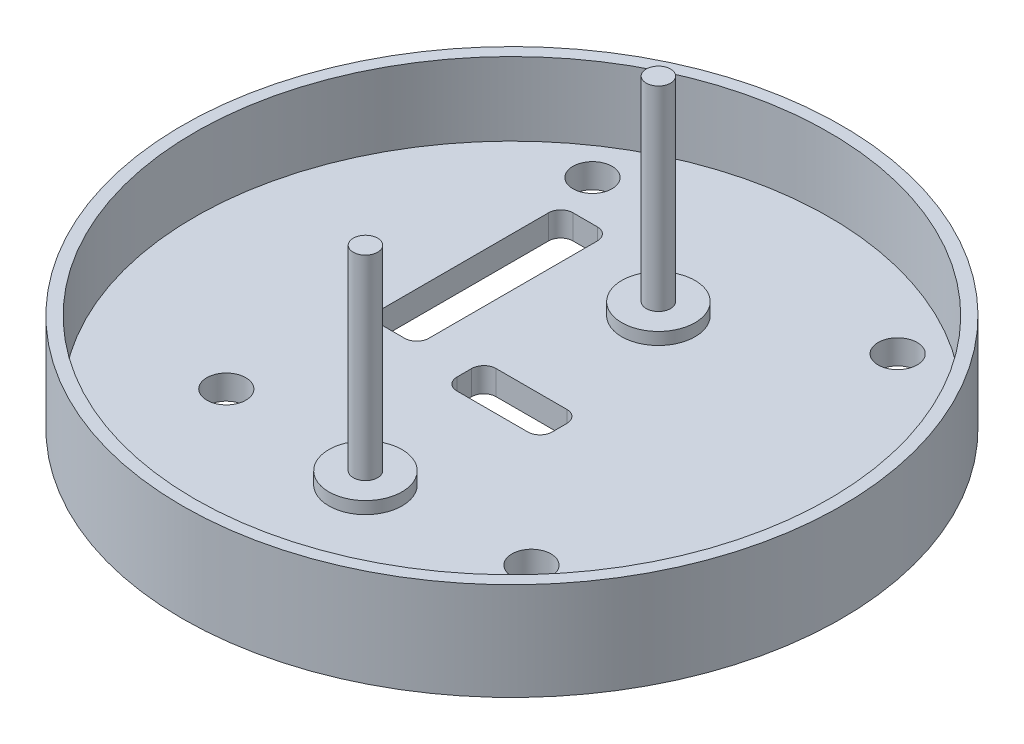
from build123d import *

# Parameters (mm, degrees)
SKETCH1_R           = 34.29
BOSS_EXTRUDE1_DEPTH = 10.16
SKETCH2_R           = 33.02
CUT_EXTRUDE1_DEPTH  = 7.62
SKETCH3_R           = 3.81
BOSS_EXTRUDE2_DEPTH = 1.27
SKETCH4_R           = 1.27
BOSS_EXTRUDE3_DEPTH = 20.32
CUT_EXTRUDE3_REACH  = 55.082
CUT_EXTRUDE4_REACH  = 55.082
CUT_EXTRUDE5_REACH  = 56.165
SKETCH11_R          = 2.032


with BuildPart() as part:
    # Sketch1 → Boss-Extrude1 (new body)
    with BuildSketch(Plane(origin=(0, 0, 0), x_dir=(1, 0, 0), z_dir=(0, 1, 0))):
        with Locations(Location((0, 0, 0), (0, 0, 270))):
            Circle(SKETCH1_R)
    extrude(amount=BOSS_EXTRUDE1_DEPTH)

    # Sketch2 → Cut-Extrude1 (cut)
    with BuildSketch(Plane(origin=(0, 10.16, 0), x_dir=(1, 0, 0), z_dir=(0, 1, 0))):
        with Locations(Location((0, 0, 0), (0, 0, 270))):
            Circle(SKETCH2_R)
    extrude(amount=-CUT_EXTRUDE1_DEPTH, mode=Mode.SUBTRACT)

    # Sketch3 → Boss-Extrude2 (add)
    with BuildSketch(Plane(origin=(0, 2.54, 0), x_dir=(1, 0, 0), z_dir=(0, 1, 0))):
        with Locations(Location((0, -15.24, 0), (0, 0, 270))):
            Circle(SKETCH3_R)
        with Locations(Location((0, 15.24, 0), (0, 0, 270))):
            Circle(SKETCH3_R)
    extrude(amount=BOSS_EXTRUDE2_DEPTH)

    # Sketch4 → Boss-Extrude3 (add)
    with BuildSketch(Plane(origin=(0, 3.81, 0), x_dir=(1, 0, 0), z_dir=(0, 1, 0))):
        with Locations(Location((0, -15.24, 0), (0, 0, 270))):
            Circle(SKETCH4_R)
        with Locations(Location((0, 15.24, 0), (0, 0, 270))):
            Circle(SKETCH4_R)
    extrude(amount=BOSS_EXTRUDE3_DEPTH)

    # Sketch8 → Cut-Extrude3 (cut, up to next)
    with BuildSketch(Plane(origin=(0, 2.54, 0), x_dir=(1, 0, 0), z_dir=(0, 1, 0)), mode=Mode.PRIVATE) as cut_extrude3_sk1:
        with BuildLine():
            Line((3.683, 2.032), (-3.683, 2.032))
            ThreePointArc((-3.683, 2.032), (-4.581025612, 1.660025612), (-4.953, 0.762))
            Line((-4.953, 0.762), (-4.953, -0.762))
            ThreePointArc((-4.953, -0.762), (-4.581025612, -1.660025612), (-3.683, -2.032))
            Line((-3.683, -2.032), (3.683, -2.032))
            ThreePointArc((3.683, -2.032), (4.581025612, -1.660025612), (4.953, -0.762))
            Line((4.953, -0.762), (4.953, 0.762))
            ThreePointArc((4.953, 0.762), (4.581025612, 1.660025612), (3.683, 2.032))
        make_face()
    cut_extrude3_tool1 = extrude(cut_extrude3_sk1.sketch, amount=-CUT_EXTRUDE3_REACH, mode=Mode.PRIVATE) & part.part
    add(cut_extrude3_tool1.solids().sort_by_distance((0, 2.54, 0))[0], mode=Mode.SUBTRACT)

    # Sketch9 → Cut-Extrude4 (cut, up to next)
    with BuildSketch(Plane(origin=(0, 2.54, 0), x_dir=(1, 0, 0), z_dir=(0, 1, 0)), mode=Mode.PRIVATE) as cut_extrude4_sk1:
        with BuildLine():
            Line((-13.716, 0), (-11.176, 0))
            ThreePointArc((-11.176, 0), (-10.277974388, 0.371974388), (-9.906, 1.27))
            Line((-9.906, 1.27), (-9.906, 18.796))
            ThreePointArc((-9.906, 18.796), (-10.277974388, 19.694025612), (-11.176, 20.066))
            Line((-11.176, 20.066), (-13.716, 20.066))
            ThreePointArc((-13.716, 20.066), (-14.614025612, 19.694025612), (-14.986, 18.796))
            Line((-14.986, 18.796), (-14.986, 1.27))
            ThreePointArc((-14.986, 1.27), (-14.614025612, 0.371974388), (-13.716, 0))
        make_face()
    cut_extrude4_tool1 = extrude(cut_extrude4_sk1.sketch, amount=-CUT_EXTRUDE4_REACH, mode=Mode.PRIVATE) & part.part
    add(cut_extrude4_tool1.solids().sort_by_distance((-12.446, 2.54, -10.033))[0], mode=Mode.SUBTRACT)

    # Sketch11 → Cut-Extrude5 (cut, up to next)
    with BuildSketch(Plane.XZ, mode=Mode.PRIVATE) as cut_extrude5_sk1:
        with Locations(Location((15.875, 13.843, 0), (0, 0, 270))):
            Circle(SKETCH11_R)
    cut_extrude5_tool1 = extrude(cut_extrude5_sk1.sketch, amount=-CUT_EXTRUDE5_REACH, mode=Mode.PRIVATE) & part.part
    # Sketch11 → Cut-Extrude5 (cut, up to next)
    with BuildSketch(Plane.XZ, mode=Mode.PRIVATE) as cut_extrude5_sk2:
        with Locations(Location((-15.875, 13.843, 0), (0, 0, 270))):
            Circle(SKETCH11_R)
    cut_extrude5_tool2 = extrude(cut_extrude5_sk2.sketch, amount=-CUT_EXTRUDE5_REACH, mode=Mode.PRIVATE) & part.part
    # Sketch11 → Cut-Extrude5 (cut, up to next)
    with BuildSketch(Plane.XZ, mode=Mode.PRIVATE) as cut_extrude5_sk3:
        with Locations(Location((-15.875, -24.257, 0), (0, 0, 270))):
            Circle(SKETCH11_R)
    cut_extrude5_tool3 = extrude(cut_extrude5_sk3.sketch, amount=-CUT_EXTRUDE5_REACH, mode=Mode.PRIVATE) & part.part
    # Sketch11 → Cut-Extrude5 (cut, up to next)
    with BuildSketch(Plane.XZ, mode=Mode.PRIVATE) as cut_extrude5_sk4:
        with Locations(Location((15.875, -24.257, 0), (0, 0, 270))):
            Circle(SKETCH11_R)
    cut_extrude5_tool4 = extrude(cut_extrude5_sk4.sketch, amount=-CUT_EXTRUDE5_REACH, mode=Mode.PRIVATE) & part.part
    add(cut_extrude5_tool1.solids().sort_by_distance((15.875, 0, 13.843))[0], mode=Mode.SUBTRACT)
    add(cut_extrude5_tool2.solids().sort_by_distance((-15.875, 0, 13.843))[0], mode=Mode.SUBTRACT)
    add(cut_extrude5_tool3.solids().sort_by_distance((-15.875, 0, -24.257))[0], mode=Mode.SUBTRACT)
    add(cut_extrude5_tool4.solids().sort_by_distance((15.875, 0, -24.257))[0], mode=Mode.SUBTRACT)


solid = part.part
